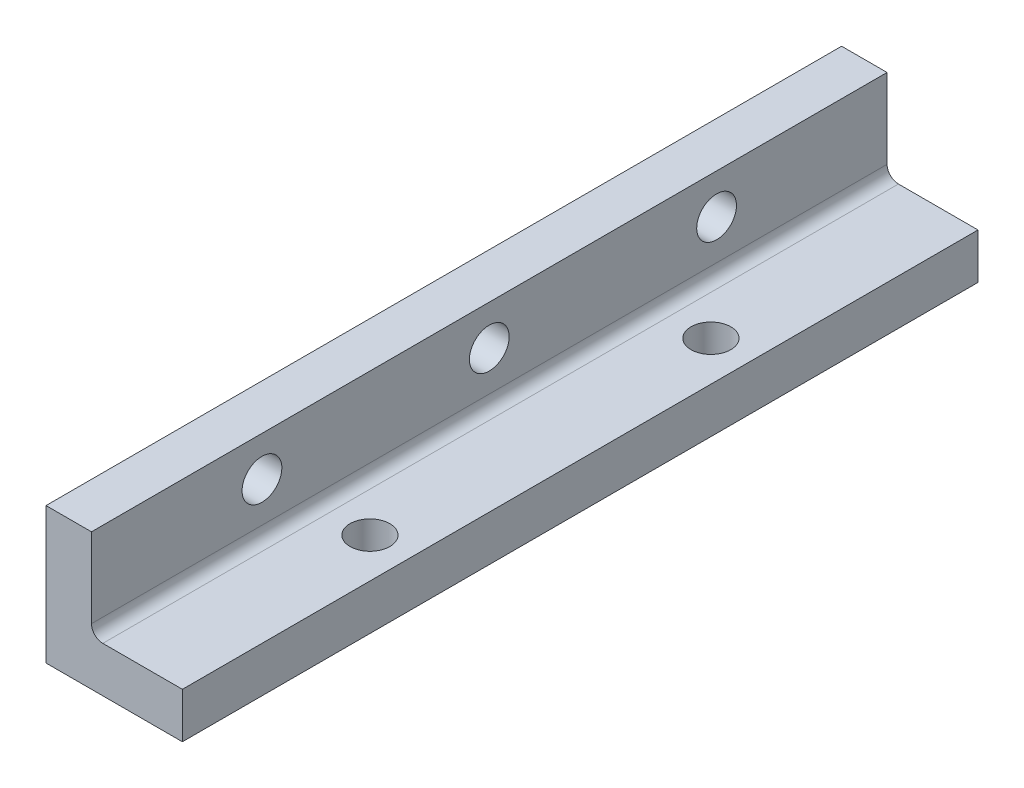
from build123d import *

# Parameters (mm, degrees)
SKETCH1_W           = 4
SKETCH1_H           = 8
SKETCH1_H_2         = 4
SKETCH1_W_2         = 8
BOSS_EXTRUDE1_DEPTH = 70
FILLET1_R           = 1
SKETCH3_R           = 1.75
CUT_EXTRUDE2_DEPTH  = 70
CUT_EXTRUDE3_REACH  = 72.83
SKETCH2_R           = 1.75


with BuildPart() as part:
    # Sketch1 → Boss-Extrude1 (new body)
    with BuildSketch(Plane.XY):
        with Locations((-5.272021997, 1.455882353)):
            Rectangle(SKETCH1_W, SKETCH1_H)
        with Locations((-5.272021997, -4.544117647)):
            Rectangle(SKETCH1_W, SKETCH1_H_2)
        with Locations((0.727978003, -4.544117647)):
            Rectangle(SKETCH1_W_2, SKETCH1_H_2)
    extrude(amount=BOSS_EXTRUDE1_DEPTH)

    # Fillet1
    fillet1_edges = [part.edges().sort_by_distance(p)[0] for p in [
        (-3.272021997, -2.544117647, 35),
    ]]
    fillet(fillet1_edges, radius=FILLET1_R)

    # Sketch3 → Cut-Extrude2 (cut)
    with BuildSketch(Plane(origin=(-3.272021997, 0, 0), x_dir=(0, 0, -1), z_dir=(1, 0, 0))):
        with Locations(Location((-55, 1.955882353, 0), (0, 0, 90))):
            Circle(SKETCH3_R)
        with Locations(Location((-15, 1.955882353, 0), (0, 0, 90))):
            Circle(SKETCH3_R)
        with Locations(Location((-35, 1.955882353, 0), (0, 0, 90))):
            Circle(SKETCH3_R)
    extrude(amount=-CUT_EXTRUDE2_DEPTH, mode=Mode.SUBTRACT)

    # Sketch2 → Cut-Extrude3 (cut, up to next)
    with BuildSketch(Plane(origin=(0, -2.544117647, 0), x_dir=(1, 0, 0), z_dir=(0, 1, 0)), mode=Mode.PRIVATE) as cut_extrude3_sk1:
        with Locations(Location((1.227978003, -50, 0), (0, 0, 270))):
            Circle(SKETCH2_R)
    cut_extrude3_tool1 = extrude(cut_extrude3_sk1.sketch, amount=-CUT_EXTRUDE3_REACH, mode=Mode.PRIVATE) & part.part
    # Sketch2 → Cut-Extrude3 (cut, up to next)
    with BuildSketch(Plane(origin=(0, -2.544117647, 0), x_dir=(1, 0, 0), z_dir=(0, 1, 0)), mode=Mode.PRIVATE) as cut_extrude3_sk2:
        with Locations(Location((1.227978003, -20, 0), (0, 0, 270))):
            Circle(SKETCH2_R)
    cut_extrude3_tool2 = extrude(cut_extrude3_sk2.sketch, amount=-CUT_EXTRUDE3_REACH, mode=Mode.PRIVATE) & part.part
    add(cut_extrude3_tool1.solids().sort_by_distance((1.227978, -2.544118, 50))[0], mode=Mode.SUBTRACT)
    add(cut_extrude3_tool2.solids().sort_by_distance((1.227978, -2.544118, 20))[0], mode=Mode.SUBTRACT)


solid = part.part
